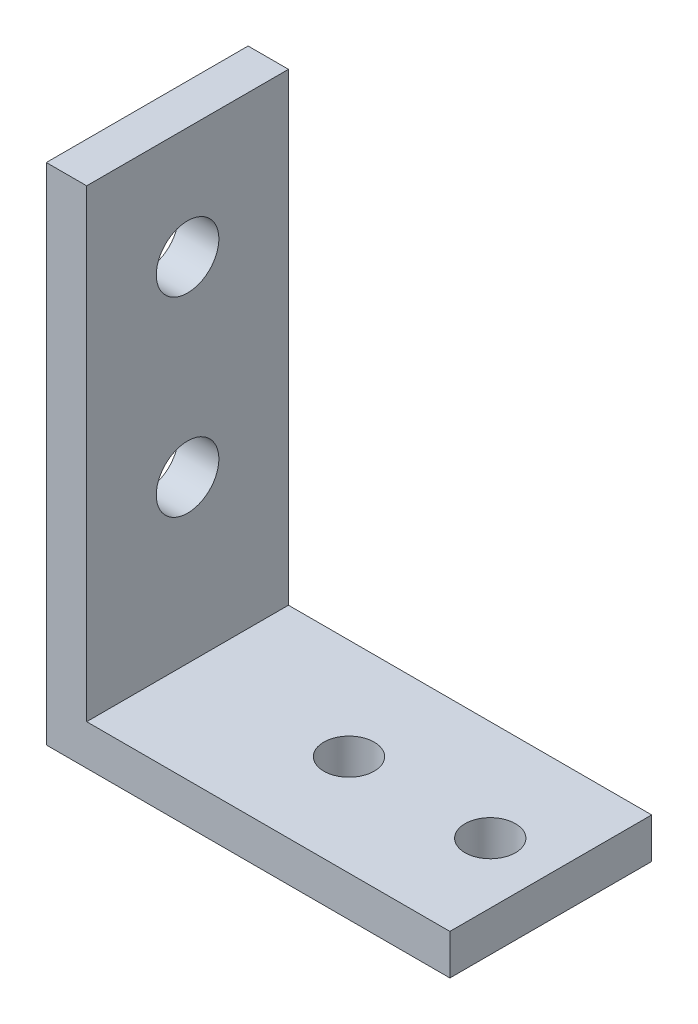
from build123d import *

# Parameters (mm, degrees)
BASE_DEPTH                   = 5
M3X0_5_MOUNTHOLES_D          = 2.5
F_3_1_3_1_LIMITSWITCHHOLES_D = 3.1


with BuildPart() as part:
    # Sketch1 → Base (new, symmetric)
    with BuildSketch(Plane.XY):
        Polygon((0, 0), (0, 25), (2, 25), (2, 2), (20, 2), (20, 0), align=None)
    extrude(amount=BASE_DEPTH, both=True)

    # M3x0.5 MountHoles (through all)
    with Locations(Plane(origin=(0, 0, 0), x_dir=(-1, 0, 0), z_dir=(0, -1, 0))):
        with Locations((-10, 0), (-17, 0)):
            Hole(M3X0_5_MOUNTHOLES_D / 2)

    # Ø3.1 (3.1) LimitSwitchHoles (through all)
    with Locations(Plane(origin=(0, 10, 0), x_dir=(0, 0, -1), z_dir=(-1, 0, 0))):
        with Locations((0, 0), (0, -9.45)):
            Hole(F_3_1_3_1_LIMITSWITCHHOLES_D / 2)


solid = part.part
